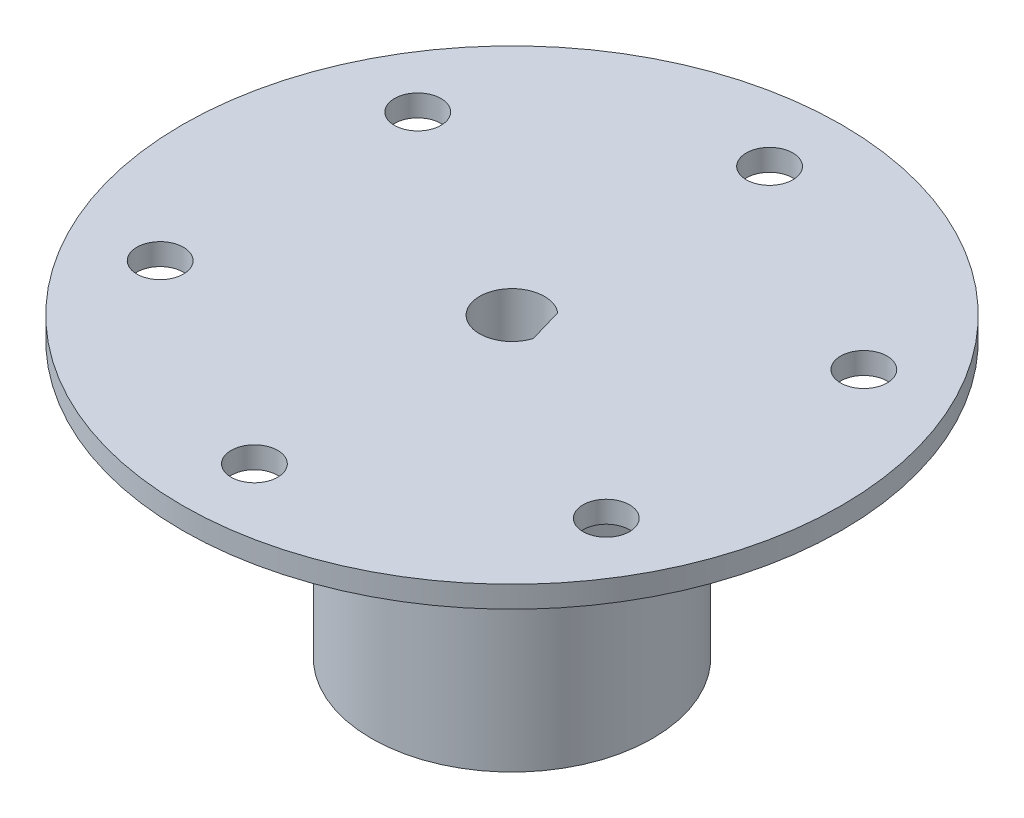
from build123d import *

# Parameters (mm, degrees)
SKETCH1_R           = 30.48
SKETCH1_R_2         = 2.15265
BOSS_EXTRUDE1_DEPTH = 2
CUT_EXTRUDE1_DEPTH  = 10
SKETCH3_R           = 13
SKETCH3_R_2         = 3.110414615
BOSS_EXTRUDE2_DEPTH = 25.4


with BuildPart() as part:
    # Sketch1 → Boss-Extrude1 (new body)
    with BuildSketch(Plane(origin=(0, 0, 0), x_dir=(1, 0, 0), z_dir=(0, 1, 0))):
        with Locations(Location((0, 0, 0), (0, 0, 270))):
            Circle(SKETCH1_R)
        with Locations(Location((0, -23.8125, 0), (0, 0, 270))):
            Circle(SKETCH1_R_2, mode=Mode.SUBTRACT)
        with Locations(Location((20.622229928, -11.90625, 0), (0, 0, 270))):
            Circle(SKETCH1_R_2, mode=Mode.SUBTRACT)
        with Locations(Location((20.622229928, 11.90625, 0), (0, 0, 270))):
            Circle(SKETCH1_R_2, mode=Mode.SUBTRACT)
        with Locations(Location((0, 23.8125, 0), (0, 0, 270))):
            Circle(SKETCH1_R_2, mode=Mode.SUBTRACT)
        with Locations(Location((-20.622229928, 11.90625, 0), (0, 0, 270))):
            Circle(SKETCH1_R_2, mode=Mode.SUBTRACT)
        with Locations(Location((-20.622229928, -11.90625, 0), (0, 0, 270))):
            Circle(SKETCH1_R_2, mode=Mode.SUBTRACT)
    extrude(amount=BOSS_EXTRUDE1_DEPTH)

    # Sketch2 → Cut-Extrude1 (cut)
    with BuildSketch(Plane(origin=(0, 2, 0), x_dir=(1, 0, 0), z_dir=(0, 1, 0))):
        with BuildLine():
            ThreePointArc((1.93204455, 2.295038966), (-2.879237228, -0.842610814), (2.864533851, -0.8913169))
            Line((2.864533851, -0.8913169), (1.93204455, 2.295038966))
        make_face()
    extrude(amount=-CUT_EXTRUDE1_DEPTH, mode=Mode.SUBTRACT)

    # Sketch3 → Boss-Extrude2 (add)
    # profile 1 of 2: a face of its own
    with BuildSketch(Plane.XZ):
        with Locations(Location((0, 0, 0), (0, 0, 90))):
            Circle(SKETCH3_R)
        Circle(SKETCH3_R_2, mode=Mode.SUBTRACT)
    # profile 2 of 2: a face of its own
    with BuildSketch(Plane.XZ):
        Circle(SKETCH3_R_2)
        with BuildLine():
            Line((2.864533851, 0.8913169), (1.93204455, -2.295038966))
            ThreePointArc((1.93204455, -2.295038966), (-2.879237228, 0.842610814), (2.864533851, 0.8913169))
        make_face(mode=Mode.SUBTRACT)
    extrude(amount=BOSS_EXTRUDE2_DEPTH)


solid = part.part
